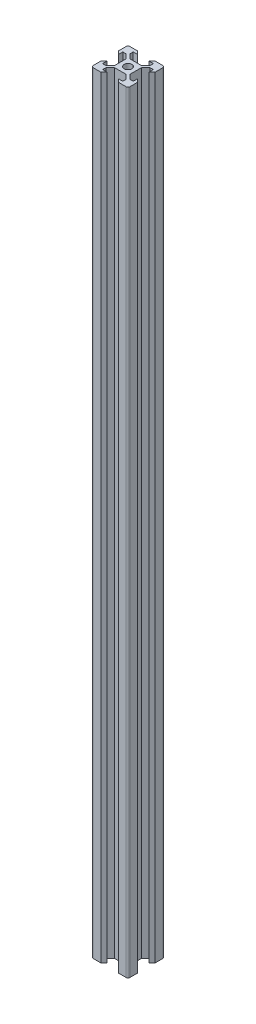
from build123d import *

# Parameters (mm, degrees)
MASTERLAYOUTSKETCH_R = 2.1
MAIN_EXTRUSION_DEPTH = 420
EDGE_FILLETS_R       = 1


with BuildPart() as part:
    # MasterLayoutSketch → Main Extrusion (new body)
    with BuildSketch(Plane(origin=(0, 0, 0), x_dir=(1, 0, 0), z_dir=(0, 1, 0))):
        Polygon((-8.325, 3.1), (-8.325, 5.5), (-6.560660172, 5.5), (-4.160660172, 3.1), (-4.160660172, -3.1), (-6.560660172, -5.5), (-8.325, -5.5), (-8.325, -3.1), (-10, -4.775), (-10, -10), (-4.775, -10), (-3.1, -8.325), (-5.5, -8.325), (-5.5, -6.560660172), (-3.1, -4.160660172), (3.1, -4.160660172), (5.5, -6.560660172), (5.5, -8.325), (3.1, -8.325), (4.775, -10), (10, -10), (10, -4.775), (8.325, -3.1), (8.325, -5.5), (6.560660172, -5.5), (4.160660172, -3.1), (4.160660172, 3.1), (6.560660172, 5.5), (8.325, 5.5), (8.325, 3.1), (10, 4.775), (10, 10), (4.775, 10), (3.1, 8.325), (5.5, 8.325), (5.5, 6.560660172), (3.1, 4.160660172), (-3.1, 4.160660172), (-5.5, 6.560660172), (-5.5, 8.325), (-3.1, 8.325), (-4.775, 10), (-10, 10), (-10, 4.775), align=None)
        with Locations(Location((0, 0, 0), (0, 0, 270))):
            Circle(MASTERLAYOUTSKETCH_R, mode=Mode.SUBTRACT)
    extrude(amount=MAIN_EXTRUSION_DEPTH)

    # Edge Fillets
    edge_fillets_edges = [part.edges().sort_by_distance(p)[0] for p in [
        (10, 210, -10),
        (10, 210, 10),
        (-10, 210, 10),
        (-10, 210, -10),
    ]]
    fillet(edge_fillets_edges, radius=EDGE_FILLETS_R)


solid = part.part
